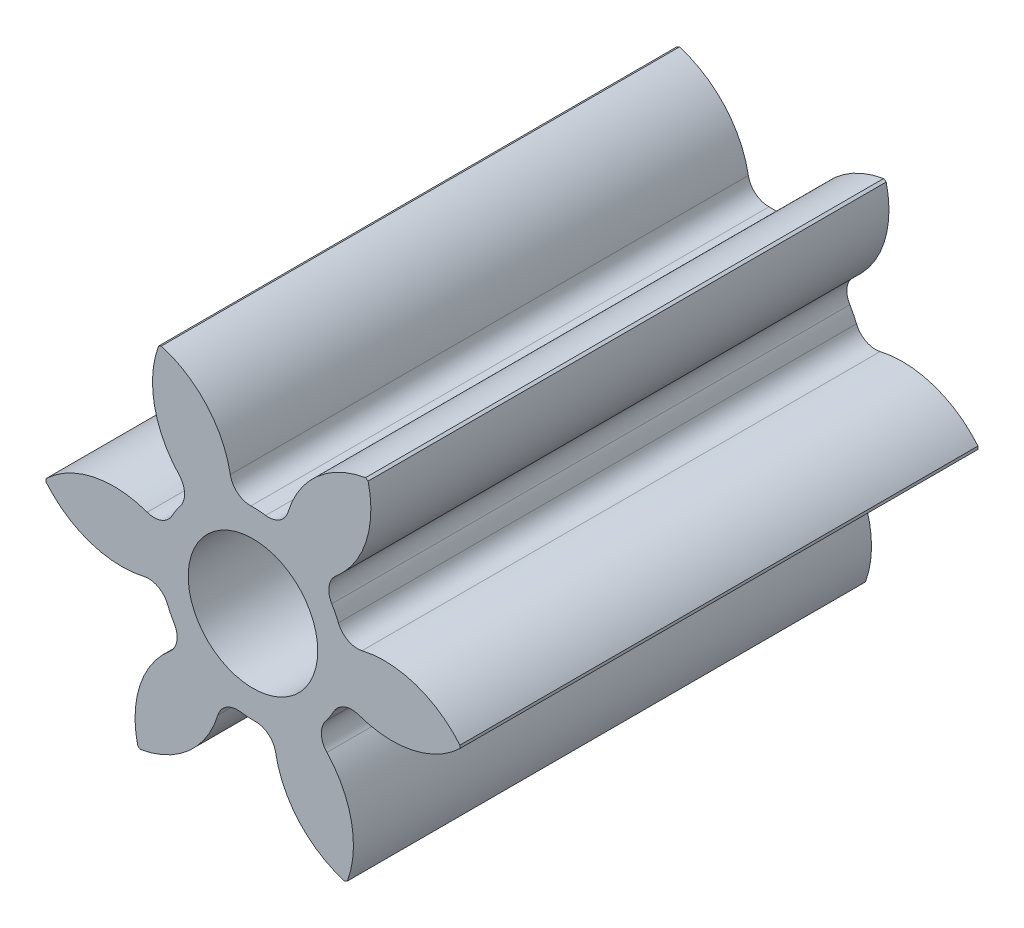
from build123d import *

# Parameters (mm, degrees)
SKETCH3_R         = 10.16
GEARBODY_DEPTH    = 25.4
TOOTHCUT_DEPTH    = 30.182378244
CIRPATTERN1_COUNT = 6
BOREDIA_R         = 3.175
BORE_DEPTH        = 12700


with BuildPart() as part:
    # Sketch3 → gearBody (new body)
    with BuildSketch(Plane.XY):
        Circle(SKETCH3_R)
    extrude(amount=GEARBODY_DEPTH)

    # Sketch2 → toothCut (cut, through all)
    with BuildSketch(Plane.XY):
        with BuildLine():
            ThreePointArc((3.5660378, -2.779320753), (3.777485663, -2.484321137), (3.964589271, -2.17331115))
            ThreePointArc((3.964589271, -2.17331115), (4.48964051, -1.716767841), (5.185396213, -1.710885794))
            ThreePointArc((5.185396213, -1.710885794), (8.833530023, -1.552224601), (11.322719982, 1.119476546))
            ThreePointArc((11.322719982, 1.119476546), (9.506315779, -6.251973755), (3.457461034, -10.839888317))
            ThreePointArc((3.457461034, -10.839888317), (4.924531858, -7.495974911), (3.625050385, -4.083438967))
            ThreePointArc((3.625050385, -4.083438967), (3.354836271, -3.442272117), (3.5660378, -2.779320753))
        make_face()
    toothcut = extrude(amount=TOOTHCUT_DEPTH, mode=Mode.SUBTRACT)

    # CirPattern1: toothCut ×6 about axis
    cirpattern1_axis = Axis((0, 0, 25.4), (0, 0, -1))
    for i in range(1, CIRPATTERN1_COUNT):
        add(toothcut.rotate(cirpattern1_axis, i * 360 / CIRPATTERN1_COUNT), mode=Mode.SUBTRACT)

    # boreDia → bore (cut, symmetric)
    with BuildSketch(Plane.XY):
        Circle(BOREDIA_R)
    extrude(amount=BORE_DEPTH, both=True, mode=Mode.SUBTRACT)


solid = part.part
